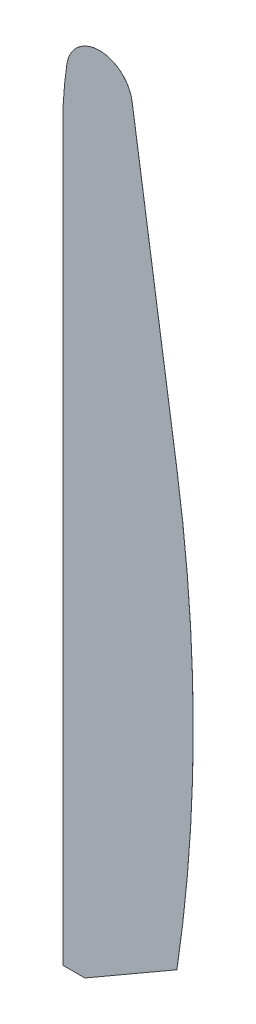
from build123d import *

# Parameters (mm, degrees)
BOSS_EXTRUDE1_DEPTH = 0.01


with BuildPart() as part:
    # Sketch1 → Boss-Extrude1 (new body)
    with BuildSketch(Plane(origin=(0, 0, 0), x_dir=(0, 1, 0), z_dir=(0, 0, 1))):
        with BuildLine():
            Line((0, 0), (165.075, 0))
            ThreePointArc((165.075, 0), (171.305056285, -0.234020268), (177.5, -0.934762134))
            ThreePointArc((177.5, -0.934762134), (183.860883028, -8.330595467), (177.5, -15.7264288))
            Line((177.5, -15.7264288), (110.364738881, -25.885416667))
            ThreePointArc((110.364738881, -25.885416667), (61.211469908, -29.583333333), (12.058200935, -25.885416667))
            Line((12.058200935, -25.885416667), (0, -5))
            Line((0, -5), (0, 0))
        make_face()
    extrude(amount=BOSS_EXTRUDE1_DEPTH)


solid = part.part
